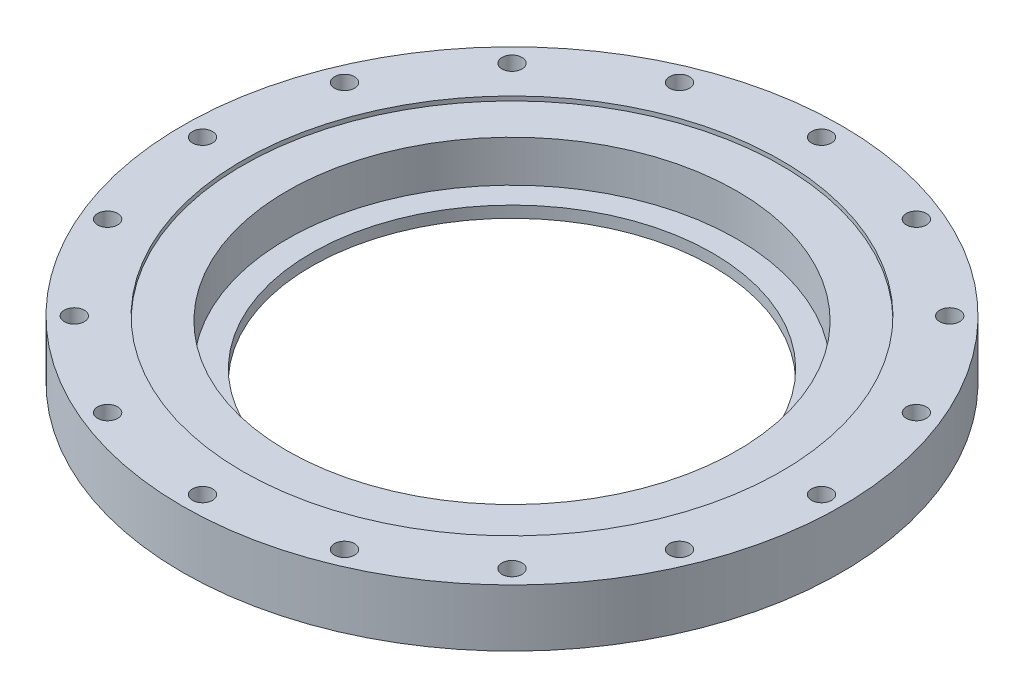
from build123d import *

# Parameters (mm, degrees)
SKETCH1_R           = 57.5
SKETCH1_R_2         = 39.25
BOSS_EXTRUDE1_DEPTH = 10
SKETCH2_R           = 1.75
CUT_EXTRUDE1_DEPTH  = 17
SKETCH3_R           = 47
CUT_EXTRUDE2_DEPTH  = 0.75
SKETCH5_R           = 2
CUT_EXTRUDE3_DEPTH  = 5
SKETCH6_R           = 39.25
SKETCH6_R_2         = 35
BOSS_EXTRUDE2_DEPTH = 2


with BuildPart() as part:
    # Sketch1 → Boss-Extrude1 (new body)
    with BuildSketch(Plane(origin=(0, 0, 0), x_dir=(1, 0, 0), z_dir=(0, 1, 0))):
        with Locations(Location((0, 0, 0), (0, 0, 270))):
            Circle(SKETCH1_R)
        with Locations(Location((0, 0, 0), (0, 0, 270))):
            Circle(SKETCH1_R_2, mode=Mode.SUBTRACT)
    extrude(amount=BOSS_EXTRUDE1_DEPTH)

    # Sketch2 → Cut-Extrude1 (cut)
    with BuildSketch(Plane(origin=(0, 10, 0), x_dir=(1, 0, 0), z_dir=(0, 1, 0))):
        with Locations(Location((0, 54, 0), (0, 0, 270))):
            Circle(SKETCH2_R)
        with Locations(Location((20.664905348, 49.889494756, 0), (0, 0, 270))):
            Circle(SKETCH2_R)
        with Locations(Location((38.183766184, 38.183766184, 0), (0, 0, 270))):
            Circle(SKETCH2_R)
        with Locations(Location((49.889494756, 20.664905348, 0), (0, 0, 270))):
            Circle(SKETCH2_R)
        with Locations(Location((54, 0, 0), (0, 0, 270))):
            Circle(SKETCH2_R)
        with Locations(Location((49.889494756, -20.664905348, 0), (0, 0, 270))):
            Circle(SKETCH2_R)
        with Locations(Location((38.183766184, -38.183766184, 0), (0, 0, 270))):
            Circle(SKETCH2_R)
        with Locations(Location((20.664905348, -49.889494756, 0), (0, 0, 270))):
            Circle(SKETCH2_R)
        with Locations(Location((0, -54, 0), (0, 0, 270))):
            Circle(SKETCH2_R)
        with Locations(Location((-20.664905348, -49.889494756, 0), (0, 0, 270))):
            Circle(SKETCH2_R)
        with Locations(Location((-38.183766184, -38.183766184, 0), (0, 0, 270))):
            Circle(SKETCH2_R)
        with Locations(Location((-49.889494756, -20.664905348, 0), (0, 0, 270))):
            Circle(SKETCH2_R)
        with Locations(Location((-54, 0, 0), (0, 0, 270))):
            Circle(SKETCH2_R)
        with Locations(Location((-49.889494756, 20.664905348, 0), (0, 0, 270))):
            Circle(SKETCH2_R)
        with Locations(Location((-38.183766184, 38.183766184, 0), (0, 0, 270))):
            Circle(SKETCH2_R)
        with Locations(Location((-20.664905348, 49.889494756, 0), (0, 0, 270))):
            Circle(SKETCH2_R)
    extrude(amount=-CUT_EXTRUDE1_DEPTH, mode=Mode.SUBTRACT)

    # Sketch3 → Cut-Extrude2 (cut)
    with BuildSketch(Plane(origin=(0, 10, 0), x_dir=(1, 0, 0), z_dir=(0, 1, 0))):
        with Locations(Location((0, 0, 0), (0, 0, 270))):
            Circle(SKETCH3_R)
    extrude(amount=-CUT_EXTRUDE2_DEPTH, mode=Mode.SUBTRACT)

    # Sketch5 → Cut-Extrude3 (cut)
    with BuildSketch(Plane.XZ):
        with Locations(Location((0, 45, 0), (0, 0, 270))):
            Circle(SKETCH5_R)
        with Locations(Location((38.97114317, -22.5, 0), (0, 0, 270))):
            Circle(SKETCH5_R)
        with Locations(Location((-38.97114317, -22.5, 0), (0, 0, 270))):
            Circle(SKETCH5_R)
    extrude(amount=-CUT_EXTRUDE3_DEPTH, mode=Mode.SUBTRACT)

    # Sketch6 → Boss-Extrude2 (add)
    with BuildSketch(Plane.XZ):
        with Locations(Location((0, 0, 0), (0, 0, 270))):
            Circle(SKETCH6_R)
        with Locations(Location((0, 0, 0), (0, 0, 270))):
            Circle(SKETCH6_R_2, mode=Mode.SUBTRACT)
    extrude(amount=-BOSS_EXTRUDE2_DEPTH)


solid = part.part
